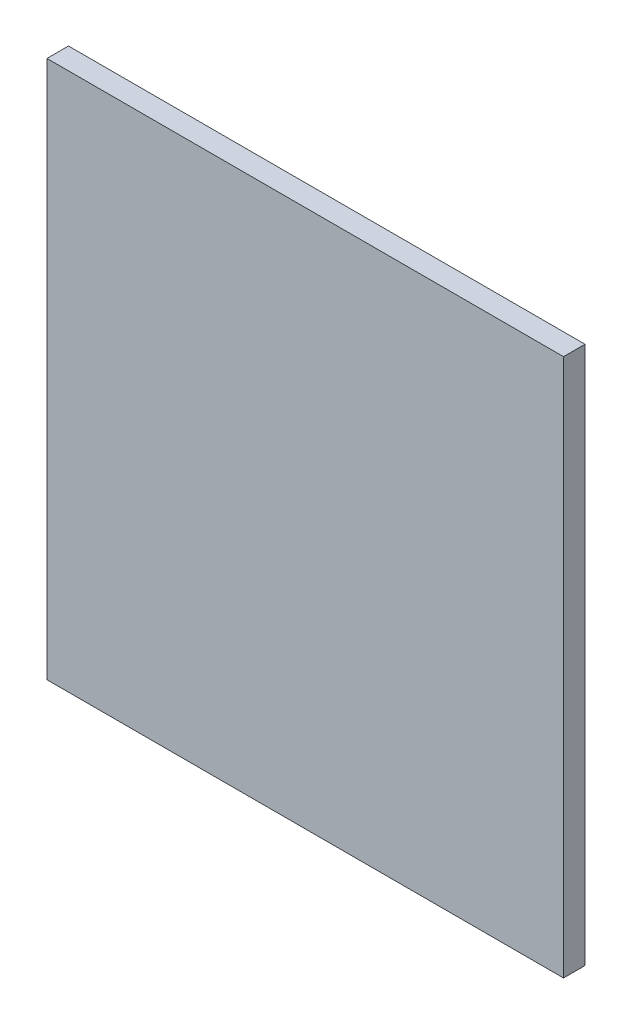
from build123d import *

# Parameters (mm, degrees)
ESQUISSE1_W        = 480
ESQUISSE1_H        = 500
BOSS_EXTRU_1_DEPTH = 20


with BuildPart() as part:
    # Esquisse1 → Boss.-Extru.1 (new body)
    with BuildSketch(Plane.XY):
        Rectangle(ESQUISSE1_W, ESQUISSE1_H)
    extrude(amount=BOSS_EXTRU_1_DEPTH)


solid = part.part
